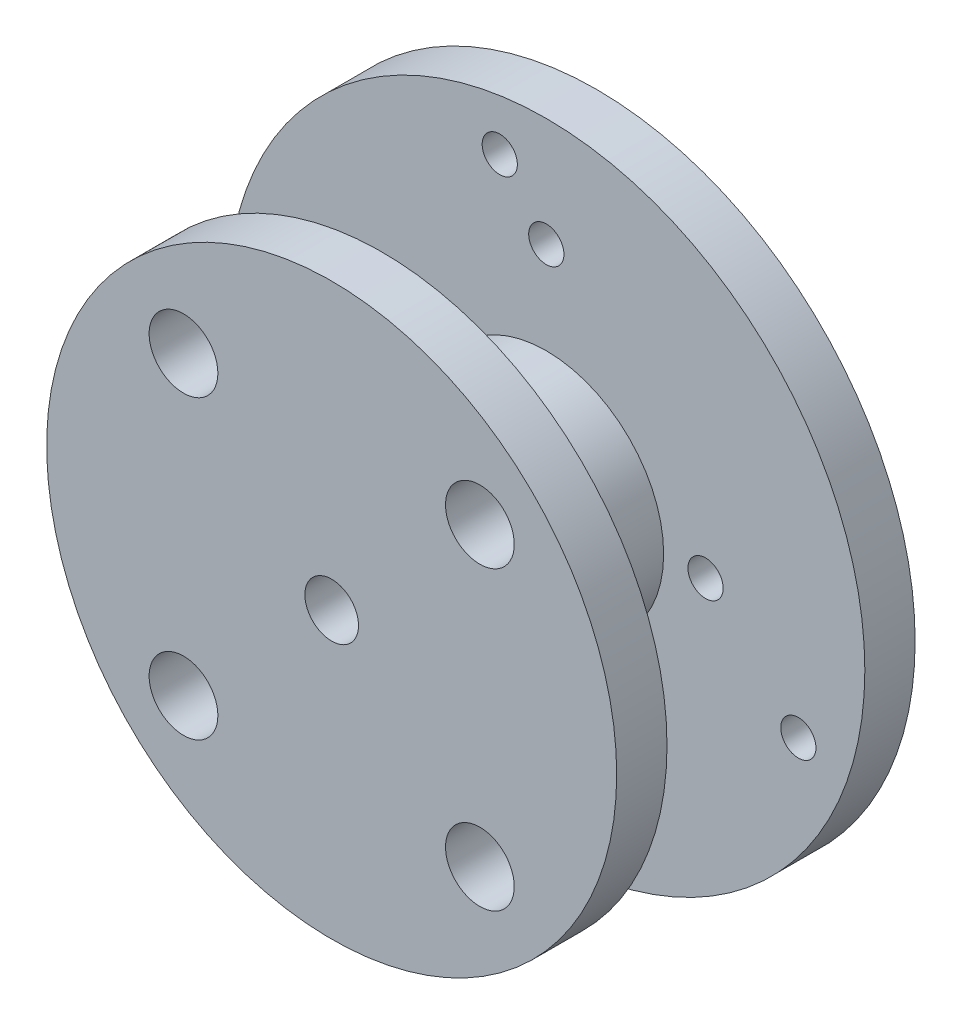
from build123d import *

# Parameters (mm, degrees)
SKETCH_1_R                  = 19
EXTRUDE_1_DEPTH             = 3
SKETCH_2_R                  = 1.05
CUT_EXTRUDE_1_DEPTH         = 28.037011669
SKETCH_3_R                  = 7
EXTRUDE_2_DEPTH             = 9.8
SKETCH_4_R                  = 17
EXTRUDE_3_DEPTH             = 3
HOLE_WIZARD_3_2_3_2_1_D     = 3.2
HOLE_WIZARD_3_2_3_2_1_DEPTH = 6
HOLE_WIZARD_3_2_3_2_1_TIP   = 0.96137699
SKETCH_7_R                  = 3
CUT_EXTRUDE_2_DEPTH         = 4
SKETCH_8_R                  = 2.05
CUT_EXTRUDE_3_DEPTH         = 4


with BuildPart() as part:
    # 草图1 → 凸台-拉伸1 (new body)
    with BuildSketch(Plane.XY):
        Circle(SKETCH_1_R)
    extrude(amount=EXTRUDE_1_DEPTH)

    # 草图2 → 切除-拉伸1 (cut, through all)
    with BuildSketch(Plane.XY.offset(3)):
        with Locations((0, 12.5)):
            Circle(SKETCH_2_R)
        with Locations((-9.5, 0)):
            Circle(SKETCH_2_R)
        with Locations((9.5, 0)):
            Circle(SKETCH_2_R)
        with Locations((0, -12.5)):
            Circle(SKETCH_2_R)
        with Locations((-2.77644219, 15.757264)):
            Circle(SKETCH_2_R)
        with Locations((15.034412013, -5.474162531)):
            Circle(SKETCH_2_R)
        with Locations((-12.257969823, -10.283101469)):
            Circle(SKETCH_2_R)
    extrude(amount=-CUT_EXTRUDE_1_DEPTH, mode=Mode.SUBTRACT)

    # 草图3 → 凸台-拉伸2 (add)
    with BuildSketch(Plane.XY.offset(3)):
        Circle(SKETCH_3_R)
    extrude(amount=EXTRUDE_2_DEPTH)

    # 草图4 → 凸台-拉伸3 (add)
    with BuildSketch(Plane.XY.offset(12.8)):
        Circle(SKETCH_4_R)
    extrude(amount=EXTRUDE_3_DEPTH)

    # Ø3.2 (3.2) 直径孔1
    with Locations(Plane.XY.offset(15.8)):
        with Locations((0, 0)):
            Hole(HOLE_WIZARD_3_2_3_2_1_D / 2, depth=HOLE_WIZARD_3_2_3_2_1_DEPTH)
            with Locations((0, 0, -(HOLE_WIZARD_3_2_3_2_1_DEPTH + HOLE_WIZARD_3_2_3_2_1_TIP / 2))):  # 118° drill point
                Cone(0, HOLE_WIZARD_3_2_3_2_1_D / 2, HOLE_WIZARD_3_2_3_2_1_TIP, mode=Mode.SUBTRACT)

    # 草图7 → 切除-拉伸2 (cut)
    with BuildSketch(Plane(origin=(0, 0, 0), x_dir=(-1, 0, 0), z_dir=(0, 0, -1))):
        Circle(SKETCH_7_R)
    extrude(amount=-CUT_EXTRUDE_2_DEPTH, mode=Mode.SUBTRACT)

    # 草图8 → 切除-拉伸3 (cut)
    with BuildSketch(Plane.XY.offset(15.8)):
        with Locations((8.838834765, 8.838834765)):
            Circle(SKETCH_8_R)
        with Locations((8.838834765, -8.838834765)):
            Circle(SKETCH_8_R)
        with Locations((-8.838834765, -8.838834765)):
            Circle(SKETCH_8_R)
        with Locations((-8.838834765, 8.838834765)):
            Circle(SKETCH_8_R)
    extrude(amount=-CUT_EXTRUDE_3_DEPTH, mode=Mode.SUBTRACT)


solid = part.part
